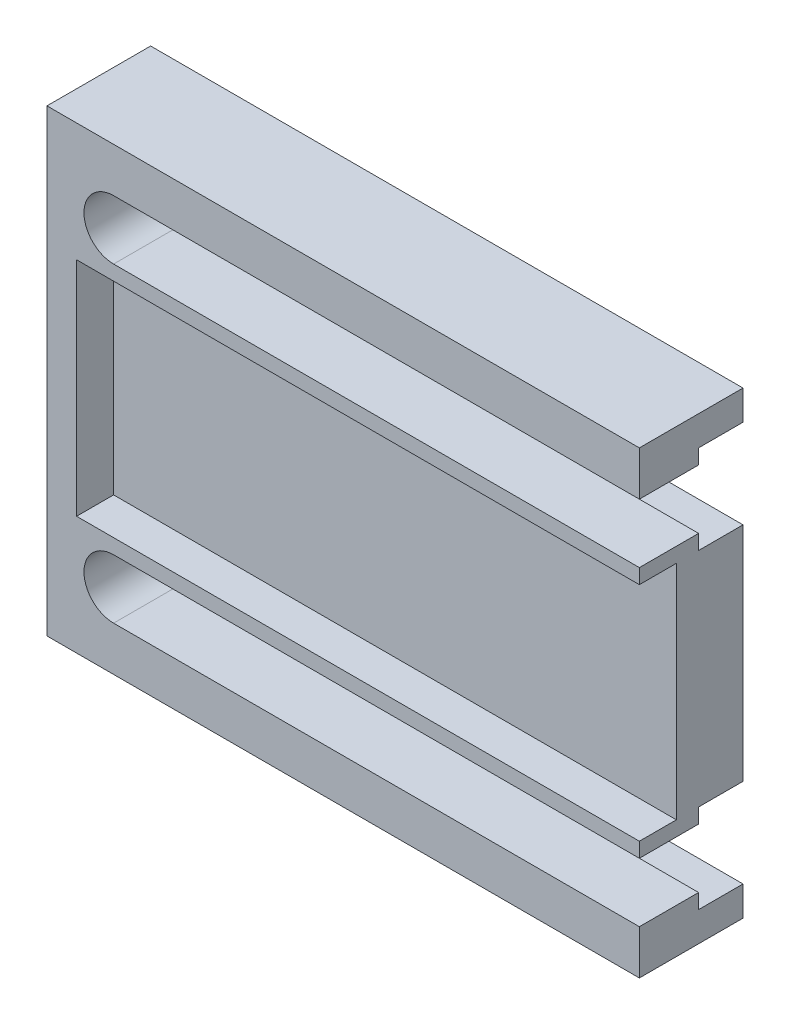
from build123d import *

# Parameters (mm, degrees)
SKETCH1_W             = 25
SKETCH1_H             = 31
IMU_BASE_DEPTH        = 7
SCREW_CHANNELS_DEPTH  = 14
NUT_CHANNELS_DEPTH    = 3
SKETCH2_W             = 23
SKETCH2_H             = 15
SOLDER_CHANNELS_DEPTH = 2.5
IMU_EXTENSION_DEPTH   = 15


with BuildPart() as part:
    # Sketch1 → IMU_Base (new body)
    with BuildSketch(Plane.XY):
        with Locations((10.5, 13.5)):
            Rectangle(SKETCH1_W, SKETCH1_H)
    extrude(amount=IMU_BASE_DEPTH)

    # Sketch1<12> → Screw_Channels (cut)
    with BuildSketch(Plane.XY):
        with BuildLine():
            ThreePointArc((2.5, 5), (0.5, 3), (2.5, 1))
            Line((2.5, 1), (23, 1))
            Line((23, 1), (23, 5))
            Line((23, 5), (2.5, 5))
        make_face()
        with BuildLine():
            Line((23, 22), (23, 26))
            Line((23, 26), (2.5, 26))
            ThreePointArc((2.5, 26), (0.5, 24), (2.5, 22))
            Line((2.5, 22), (23, 22))
        make_face()
    extrude(amount=SCREW_CHANNELS_DEPTH, mode=Mode.SUBTRACT)

    # Sketch1<13> → Nut_Channels (cut)
    with BuildSketch(Plane.XY):
        with BuildLine():
            Line((0, 0), (23, 0))
            Line((23, 0), (23, 1))
            Line((23, 1), (2.5, 1))
            ThreePointArc((2.5, 1), (0.5, 3), (2.5, 5))
            Line((2.5, 5), (23, 5))
            Line((23, 5), (23, 6))
            Line((23, 6), (0, 6))
            Line((0, 6), (0, 0))
        make_face()
        with BuildLine():
            Line((0, 21), (23, 21))
            Line((23, 21), (23, 22))
            Line((23, 22), (2.5, 22))
            ThreePointArc((2.5, 22), (0.5, 24), (2.5, 26))
            Line((2.5, 26), (23, 26))
            Line((23, 26), (23, 27))
            Line((23, 27), (0, 27))
            Line((0, 27), (0, 21))
        make_face()
    extrude(amount=NUT_CHANNELS_DEPTH, mode=Mode.SUBTRACT)

    # Sketch2 → Solder_Channels (cut)
    with BuildSketch(Plane.XY.offset(7)):
        with Locations((11.5, 13.5)):
            Rectangle(SKETCH2_W, SKETCH2_H)
    extrude(amount=-SOLDER_CHANNELS_DEPTH, mode=Mode.SUBTRACT)

    # Sketch4 → IMU_Extension (add)
    with BuildSketch(Plane(origin=(23, 0, 0), x_dir=(0, 0, -1), z_dir=(1, 0, 0))):
        Polygon((-7, 26), (-7, 29), (0, 29), (0, 27), (-3, 27), (-3, 26), align=None)
        Polygon((-7, 22), (-3, 22), (-3, 21), (0, 21), (0, 6), (-3, 6), (-3, 5), (-7, 5), (-7, 6), (-4.5, 6), (-4.5, 21), (-7, 21), align=None)
        Polygon((-7, 1), (-3, 1), (-3, 0), (0, 0), (0, -2), (-7, -2), align=None)
    extrude(amount=IMU_EXTENSION_DEPTH)


solid = part.part
